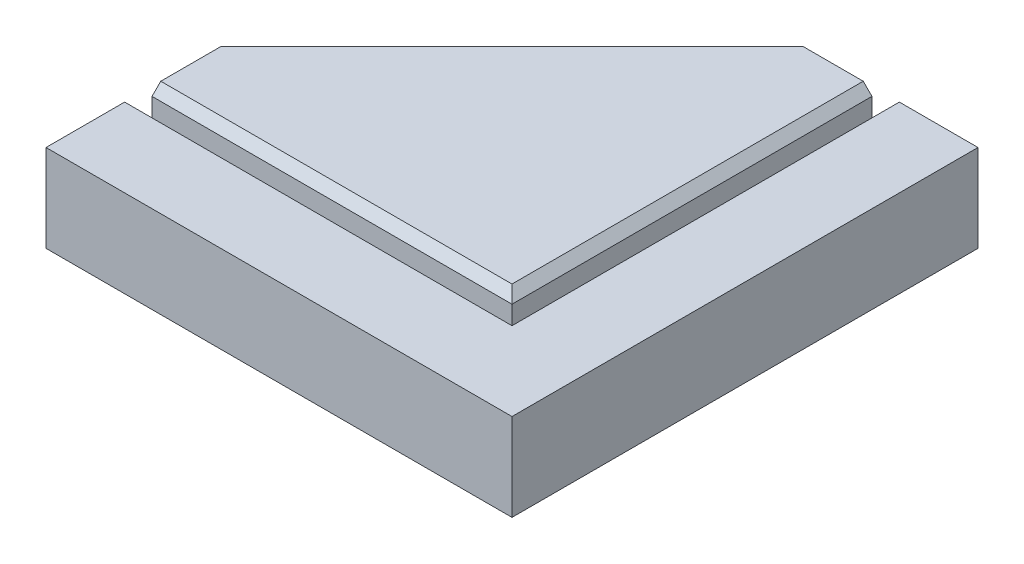
from build123d import *

# Parameters (mm, degrees)
SKETCH1_W           = 80
SKETCH1_H           = 80
BOSS_EXTRUDE1_DEPTH = 15
CUT_EXTRUDE2_DEPTH  = 8
CHAMFER3_SIZE       = 1.5
CUT_EXTRUDE3_DEPTH  = 115.127122105


with BuildPart() as part:
    # Sketch1 → Boss-Extrude1 (new body)
    with BuildSketch(Plane(origin=(0, 0, 0), x_dir=(1, 0, 0), z_dir=(0, 1, 0))):
        with Locations((40, 40)):
            Rectangle(SKETCH1_W, SKETCH1_H)
    extrude(amount=BOSS_EXTRUDE1_DEPTH)

    # Sketch3 → Cut-Extrude2 (cut)
    with BuildSketch(Plane(origin=(0, 15, 0), x_dir=(1, 0, 0), z_dir=(0, 1, 0))):
        Polygon((65, 80), (61.8, 80), (61.8, 18.2), (0, 18.2), (0, 15), (65, 15), align=None)
    extrude(amount=-CUT_EXTRUDE2_DEPTH, mode=Mode.SUBTRACT)

    # Chamfer3
    chamfer3_edges = [part.edges().sort_by_distance(p)[0] for p in [
        (65, 15, -47.5),
        (61.8, 15, -49.1),
        (30.9, 15, -18.2),
        (32.5, 15, -15),
    ]]
    chamfer(chamfer3_edges, length=CHAMFER3_SIZE)

    # Sketch4 → Cut-Extrude3 (cut, through all)
    with BuildSketch(Plane(origin=(0, 15, 0), x_dir=(1, 0, 0), z_dir=(0, 1, 0))):
        Polygon((0, 80), (50, 80), (0, 30), align=None)
    extrude(amount=-CUT_EXTRUDE3_DEPTH, mode=Mode.SUBTRACT)


solid = part.part
